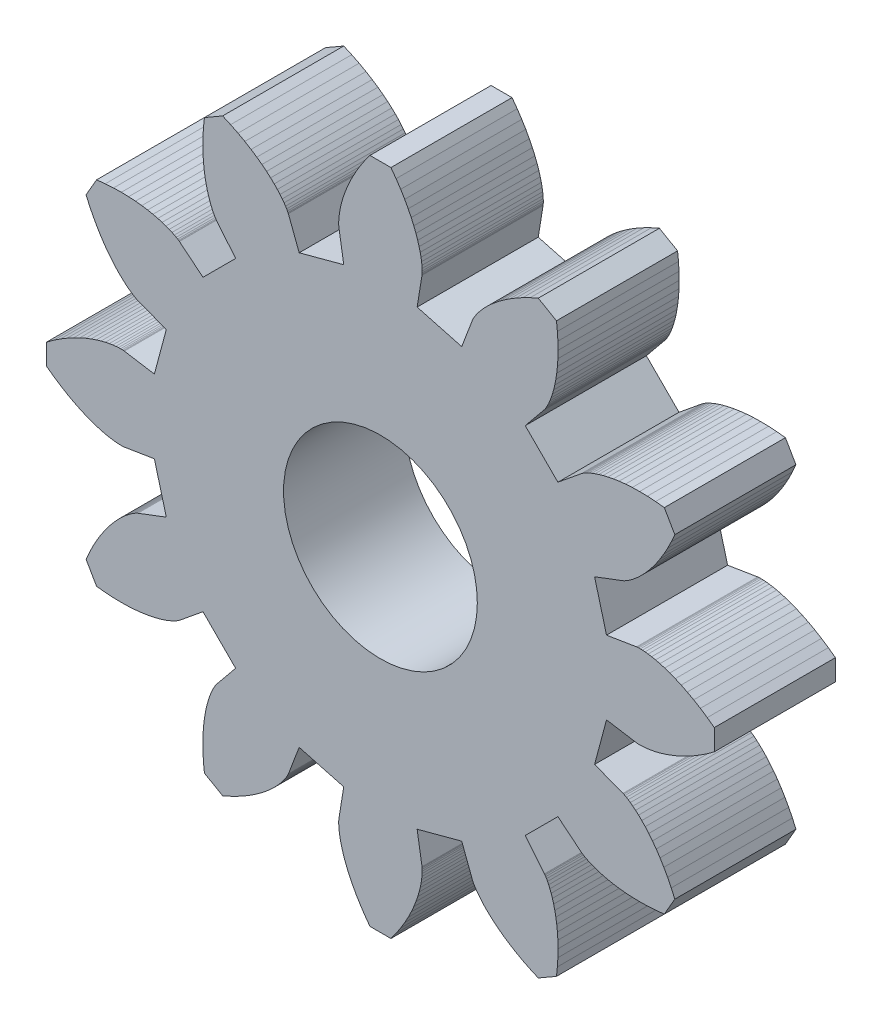
from build123d import *

# Parameters (mm, degrees)
MODEL_R             = 4
BOSS_EXTRUDE3_DEPTH = 5


with BuildPart() as part:
    # Model → Boss-Extrude3 (new body)
    with BuildSketch(Plane.XY):
        Polygon((9.333364999, 1.514596968), (10.573626722, 1.715863783), (10.583289612, 1.717151003), (10.612403196, 1.719910749), (10.661075352, 1.722482773), (10.729307624, 1.723201811), (10.816995048, 1.720403639), (10.923926316, 1.712431129), (11.04978425, 1.697640286), (11.194146603, 1.674406264), (11.356487178, 1.641129322), (11.536177269, 1.596240731), (11.732487407, 1.538208587), (11.944589424, 1.465543541), (12.171558814, 1.376804409), (12.412377397, 1.27060366), (12.665936273, 1.145612758), (12.931039061, 1.000567352), (13.206405413, 0.834272291), (13.490674795, 0.645606451), (13.782410533, 0.433527374), (13.782410533, -0.433527374), (13.490674795, -0.645606451), (13.206405413, -0.834272291), (12.931039061, -1.000567352), (12.665936273, -1.145612758), (12.412377397, -1.27060366), (12.171558814, -1.376804409), (11.944589424, -1.465543541), (11.732487407, -1.538208587), (11.536177269, -1.596240731), (11.356487178, -1.641129322), (11.194146603, -1.674406264), (11.04978425, -1.697640286), (10.923926316, -1.712431129), (10.816995048, -1.720403639), (10.729307624, -1.723201811), (10.661075352, -1.722482773), (10.612403196, -1.719910749), (10.583289612, -1.717151003), (10.573626722, -1.715863783), (9.333364999, -1.514596968), (8.840229676, -3.355003049), (10.014961243, -3.800831736), (10.023973161, -3.804548416), (10.050566138, -3.816715197), (10.094003473, -3.838823837), (10.153453873, -3.872317268), (10.227994324, -3.918584268), (10.316613263, -3.978954298), (10.41821401, -4.054692511), (10.531618463, -4.14699494), (10.655571055, -4.256983905), (10.788742943, -4.385703611), (10.929736438, -4.534115991), (11.077089649, -4.703096776), (11.229281341, -4.893431813), (11.384735977, -5.105813651), (11.541828954, -5.340838385), (11.698892, -5.599002785), (11.854218725, -5.880701709), (12.006070313, -6.18622581), (12.152681334, -6.515759547), (11.71915396, -7.266650986), (11.360463861, -7.304448985), (11.019946435, -7.325703704), (10.698324648, -7.332036276), (10.396216196, -7.325097888), (10.114132318, -7.306563746), (9.852476932, -7.278127001), (9.611546109, -7.241492649), (9.391527851, -7.198371416), (9.192502212, -7.150473658), (9.014441733, -7.099503273), (8.8572122, -7.047151662), (8.720573724, -6.99509174), (8.604182135, -6.944972018), (8.507590685, -6.89841078), (8.430252062, -6.856990356), (8.3715207, -6.822251515), (8.330655388, -6.795687999), (8.306822159, -6.778741197), (8.29909746, -6.772794987), (7.325632708, -5.978361951), (5.978361951, -7.325632708), (6.772794987, -8.29909746), (6.778741197, -8.306822159), (6.795687999, -8.330655388), (6.822251515, -8.3715207), (6.856990356, -8.430252062), (6.89841078, -8.507590685), (6.944972018, -8.604182135), (6.99509174, -8.720573724), (7.047151662, -8.8572122), (7.099503273, -9.014441733), (7.150473658, -9.192502212), (7.198371416, -9.391527851), (7.241492649, -9.611546109), (7.278127001, -9.852476932), (7.306563746, -10.114132318), (7.325097888, -10.396216196), (7.332036276, -10.698324648), (7.325703704, -11.019946435), (7.304448985, -11.360463861), (7.266650986, -11.71915396), (6.515759547, -12.152681334), (6.18622581, -12.006070313), (5.880701709, -11.854218725), (5.599002785, -11.698892), (5.340838385, -11.541828954), (5.105813651, -11.384735977), (4.893431813, -11.229281341), (4.703096776, -11.077089649), (4.534115991, -10.929736438), (4.385703611, -10.788742943), (4.256983905, -10.655571055), (4.14699494, -10.531618463), (4.054692511, -10.41821401), (3.978954298, -10.316613263), (3.918584268, -10.227994324), (3.872317268, -10.153453873), (3.838823837, -10.094003473), (3.816715197, -10.050566138), (3.804548416, -10.023973161), (3.800831736, -10.014961243), (3.355003049, -8.840229676), (1.514596968, -9.333364999), (1.715863783, -10.573626722), (1.717151003, -10.583289612), (1.719910749, -10.612403196), (1.722482773, -10.661075352), (1.723201811, -10.729307624), (1.720403639, -10.816995048), (1.712431129, -10.923926316), (1.697640286, -11.04978425), (1.674406264, -11.194146603), (1.641129322, -11.356487178), (1.596240731, -11.536177269), (1.538208587, -11.732487407), (1.465543541, -11.944589424), (1.376804409, -12.171558814), (1.27060366, -12.412377397), (1.145612758, -12.665936273), (1.000567352, -12.931039061), (0.834272291, -13.206405413), (0.645606451, -13.490674795), (0.433527374, -13.782410533), (-0.433527374, -13.782410533), (-0.645606451, -13.490674795), (-0.834272291, -13.206405413), (-1.000567352, -12.931039061), (-1.145612758, -12.665936273), (-1.27060366, -12.412377397), (-1.376804409, -12.171558814), (-1.465543541, -11.944589424), (-1.538208587, -11.732487407), (-1.596240731, -11.536177269), (-1.641129322, -11.356487178), (-1.674406264, -11.194146603), (-1.697640286, -11.04978425), (-1.712431129, -10.923926316), (-1.720403639, -10.816995048), (-1.723201811, -10.729307624), (-1.722482773, -10.661075352), (-1.719910749, -10.612403196), (-1.717151003, -10.583289612), (-1.715863783, -10.573626722), (-1.514596968, -9.333364999), (-3.355003049, -8.840229676), (-3.800831736, -10.014961243), (-3.804548416, -10.023973161), (-3.816715197, -10.050566138), (-3.838823837, -10.094003473), (-3.872317268, -10.153453873), (-3.918584268, -10.227994324), (-3.978954298, -10.316613263), (-4.054692511, -10.41821401), (-4.14699494, -10.531618463), (-4.256983905, -10.655571055), (-4.385703611, -10.788742943), (-4.534115991, -10.929736438), (-4.703096776, -11.077089649), (-4.893431813, -11.229281341), (-5.105813651, -11.384735977), (-5.340838385, -11.541828954), (-5.599002785, -11.698892), (-5.880701709, -11.854218725), (-6.18622581, -12.006070313), (-6.515759547, -12.152681334), (-7.266650986, -11.71915396), (-7.304448985, -11.360463861), (-7.325703704, -11.019946435), (-7.332036276, -10.698324648), (-7.325097888, -10.396216196), (-7.306563746, -10.114132318), (-7.278127001, -9.852476932), (-7.241492649, -9.611546109), (-7.198371416, -9.391527851), (-7.150473658, -9.192502212), (-7.099503273, -9.014441733), (-7.047151662, -8.8572122), (-6.99509174, -8.720573724), (-6.944972018, -8.604182135), (-6.89841078, -8.507590685), (-6.856990356, -8.430252062), (-6.822251515, -8.3715207), (-6.795687999, -8.330655388), (-6.778741197, -8.306822159), (-6.772794987, -8.29909746), (-5.978361951, -7.325632708), (-7.325632708, -5.978361951), (-8.29909746, -6.772794987), (-8.306822159, -6.778741197), (-8.330655388, -6.795687999), (-8.3715207, -6.822251515), (-8.430252062, -6.856990356), (-8.507590685, -6.89841078), (-8.604182135, -6.944972018), (-8.720573724, -6.99509174), (-8.8572122, -7.047151662), (-9.014441733, -7.099503273), (-9.192502212, -7.150473658), (-9.391527851, -7.198371416), (-9.611546109, -7.241492649), (-9.852476932, -7.278127001), (-10.114132318, -7.306563746), (-10.396216196, -7.325097888), (-10.698324648, -7.332036276), (-11.019946435, -7.325703704), (-11.360463861, -7.304448985), (-11.71915396, -7.266650986), (-12.152681334, -6.515759547), (-12.006070313, -6.18622581), (-11.854218725, -5.880701709), (-11.698892, -5.599002785), (-11.541828954, -5.340838385), (-11.384735977, -5.105813651), (-11.229281341, -4.893431813), (-11.077089649, -4.703096776), (-10.929736438, -4.534115991), (-10.788742943, -4.385703611), (-10.655571055, -4.256983905), (-10.531618463, -4.14699494), (-10.41821401, -4.054692511), (-10.316613263, -3.978954298), (-10.227994324, -3.918584268), (-10.153453873, -3.872317268), (-10.094003473, -3.838823837), (-10.050566138, -3.816715197), (-10.023973161, -3.804548416), (-10.014961243, -3.800831736), (-8.840229676, -3.355003049), (-9.333364999, -1.514596968), (-10.573626722, -1.715863783), (-10.583289612, -1.717151003), (-10.612403196, -1.719910749), (-10.661075352, -1.722482773), (-10.729307624, -1.723201811), (-10.816995048, -1.720403639), (-10.923926316, -1.712431129), (-11.04978425, -1.697640286), (-11.194146603, -1.674406264), (-11.356487178, -1.641129322), (-11.536177269, -1.596240731), (-11.732487407, -1.538208587), (-11.944589424, -1.465543541), (-12.171558814, -1.376804409), (-12.412377397, -1.27060366), (-12.665936273, -1.145612758), (-12.931039061, -1.000567352), (-13.206405413, -0.834272291), (-13.490674795, -0.645606451), (-13.782410533, -0.433527374), (-13.782410533, 0.433527374), (-13.490674795, 0.645606451), (-13.206405413, 0.834272291), (-12.931039061, 1.000567352), (-12.665936273, 1.145612758), (-12.412377397, 1.27060366), (-12.171558814, 1.376804409), (-11.944589424, 1.465543541), (-11.732487407, 1.538208587), (-11.536177269, 1.596240731), (-11.356487178, 1.641129322), (-11.194146603, 1.674406264), (-11.04978425, 1.697640286), (-10.923926316, 1.712431129), (-10.816995048, 1.720403639), (-10.729307624, 1.723201811), (-10.661075352, 1.722482773), (-10.612403196, 1.719910749), (-10.583289612, 1.717151003), (-10.573626722, 1.715863783), (-9.333364999, 1.514596968), (-8.840229676, 3.355003049), (-10.014961243, 3.800831736), (-10.023973161, 3.804548416), (-10.050566138, 3.816715197), (-10.094003473, 3.838823837), (-10.153453873, 3.872317268), (-10.227994324, 3.918584268), (-10.316613263, 3.978954298), (-10.41821401, 4.054692511), (-10.531618463, 4.14699494), (-10.655571055, 4.256983905), (-10.788742943, 4.385703611), (-10.929736438, 4.534115991), (-11.077089649, 4.703096776), (-11.229281341, 4.893431813), (-11.384735977, 5.105813651), (-11.541828954, 5.340838385), (-11.698892, 5.599002785), (-11.854218725, 5.880701709), (-12.006070313, 6.18622581), (-12.152681334, 6.515759547), (-11.71915396, 7.266650986), (-11.360463861, 7.304448985), (-11.019946435, 7.325703704), (-10.698324648, 7.332036276), (-10.396216196, 7.325097888), (-10.114132318, 7.306563746), (-9.852476932, 7.278127001), (-9.611546109, 7.241492649), (-9.391527851, 7.198371416), (-9.192502212, 7.150473658), (-9.014441733, 7.099503273), (-8.8572122, 7.047151662), (-8.720573724, 6.99509174), (-8.604182135, 6.944972018), (-8.507590685, 6.89841078), (-8.430252062, 6.856990356), (-8.3715207, 6.822251515), (-8.330655388, 6.795687999), (-8.306822159, 6.778741197), (-8.29909746, 6.772794987), (-7.325632708, 5.978361951), (-5.978361951, 7.325632708), (-6.772794987, 8.29909746), (-6.778741197, 8.306822159), (-6.795687999, 8.330655388), (-6.822251515, 8.3715207), (-6.856990356, 8.430252062), (-6.89841078, 8.507590685), (-6.944972018, 8.604182135), (-6.99509174, 8.720573724), (-7.047151662, 8.8572122), (-7.099503273, 9.014441733), (-7.150473658, 9.192502212), (-7.198371416, 9.391527851), (-7.241492649, 9.611546109), (-7.278127001, 9.852476932), (-7.306563746, 10.114132318), (-7.325097888, 10.396216196), (-7.332036276, 10.698324648), (-7.325703704, 11.019946435), (-7.304448985, 11.360463861), (-7.266650986, 11.71915396), (-6.515759547, 12.152681334), (-6.18622581, 12.006070313), (-5.880701709, 11.854218725), (-5.599002785, 11.698892), (-5.340838385, 11.541828954), (-5.105813651, 11.384735977), (-4.893431813, 11.229281341), (-4.703096776, 11.077089649), (-4.534115991, 10.929736438), (-4.385703611, 10.788742943), (-4.256983905, 10.655571055), (-4.14699494, 10.531618463), (-4.054692511, 10.41821401), (-3.978954298, 10.316613263), (-3.918584268, 10.227994324), (-3.872317268, 10.153453873), (-3.838823837, 10.094003473), (-3.816715197, 10.050566138), (-3.804548416, 10.023973161), (-3.800831736, 10.014961243), (-3.355003049, 8.840229676), (-1.514596968, 9.333364999), (-1.715863783, 10.573626722), (-1.717151003, 10.583289612), (-1.719910749, 10.612403196), (-1.722482773, 10.661075352), (-1.723201811, 10.729307624), (-1.720403639, 10.816995048), (-1.712431129, 10.923926316), (-1.697640286, 11.04978425), (-1.674406264, 11.194146603), (-1.641129322, 11.356487178), (-1.596240731, 11.536177269), (-1.538208587, 11.732487407), (-1.465543541, 11.944589424), (-1.376804409, 12.171558814), (-1.27060366, 12.412377397), (-1.145612758, 12.665936273), (-1.000567352, 12.931039061), (-0.834272291, 13.206405413), (-0.645606451, 13.490674795), (-0.433527374, 13.782410533), (0.433527374, 13.782410533), (0.645606451, 13.490674795), (0.834272291, 13.206405413), (1.000567352, 12.931039061), (1.145612758, 12.665936273), (1.27060366, 12.412377397), (1.376804409, 12.171558814), (1.465543541, 11.944589424), (1.538208587, 11.732487407), (1.596240731, 11.536177269), (1.641129322, 11.356487178), (1.674406264, 11.194146603), (1.697640286, 11.04978425), (1.712431129, 10.923926316), (1.720403639, 10.816995048), (1.723201811, 10.729307624), (1.722482773, 10.661075352), (1.719910749, 10.612403196), (1.717151003, 10.583289612), (1.715863783, 10.573626722), (1.514596968, 9.333364999), (3.355003049, 8.840229676), (3.800831736, 10.014961243), (3.804548416, 10.023973161), (3.816715197, 10.050566138), (3.838823837, 10.094003473), (3.872317268, 10.153453873), (3.918584268, 10.227994324), (3.978954298, 10.316613263), (4.054692511, 10.41821401), (4.14699494, 10.531618463), (4.256983905, 10.655571055), (4.385703611, 10.788742943), (4.534115991, 10.929736438), (4.703096776, 11.077089649), (4.893431813, 11.229281341), (5.105813651, 11.384735977), (5.340838385, 11.541828954), (5.599002785, 11.698892), (5.880701709, 11.854218725), (6.18622581, 12.006070313), (6.515759547, 12.152681334), (7.266650986, 11.71915396), (7.304448985, 11.360463861), (7.325703704, 11.019946435), (7.332036276, 10.698324648), (7.325097888, 10.396216196), (7.306563746, 10.114132318), (7.278127001, 9.852476932), (7.241492649, 9.611546109), (7.198371416, 9.391527851), (7.150473658, 9.192502212), (7.099503273, 9.014441733), (7.047151662, 8.8572122), (6.99509174, 8.720573724), (6.944972018, 8.604182135), (6.89841078, 8.507590685), (6.856990356, 8.430252062), (6.822251515, 8.3715207), (6.795687999, 8.330655388), (6.778741197, 8.306822159), (6.772794987, 8.29909746), (5.978361951, 7.325632708), (7.325632708, 5.978361951), (8.29909746, 6.772794987), (8.306822159, 6.778741197), (8.330655388, 6.795687999), (8.3715207, 6.822251515), (8.430252062, 6.856990356), (8.507590685, 6.89841078), (8.604182135, 6.944972018), (8.720573724, 6.99509174), (8.8572122, 7.047151662), (9.014441733, 7.099503273), (9.192502212, 7.150473658), (9.391527851, 7.198371416), (9.611546109, 7.241492649), (9.852476932, 7.278127001), (10.114132318, 7.306563746), (10.396216196, 7.325097888), (10.698324648, 7.332036276), (11.019946435, 7.325703704), (11.360463861, 7.304448985), (11.71915396, 7.266650986), (12.152681334, 6.515759547), (12.006070313, 6.18622581), (11.854218725, 5.880701709), (11.698892, 5.599002785), (11.541828954, 5.340838385), (11.384735977, 5.105813651), (11.229281341, 4.893431813), (11.077089649, 4.703096776), (10.929736438, 4.534115991), (10.788742943, 4.385703611), (10.655571055, 4.256983905), (10.531618463, 4.14699494), (10.41821401, 4.054692511), (10.316613263, 3.978954298), (10.227994324, 3.918584268), (10.153453873, 3.872317268), (10.094003473, 3.838823837), (10.050566138, 3.816715197), (10.023973161, 3.804548416), (10.014961243, 3.800831736), (8.840229676, 3.355003049), align=None)
        Circle(MODEL_R, mode=Mode.SUBTRACT)
    extrude(amount=BOSS_EXTRUDE3_DEPTH)


solid = part.part
